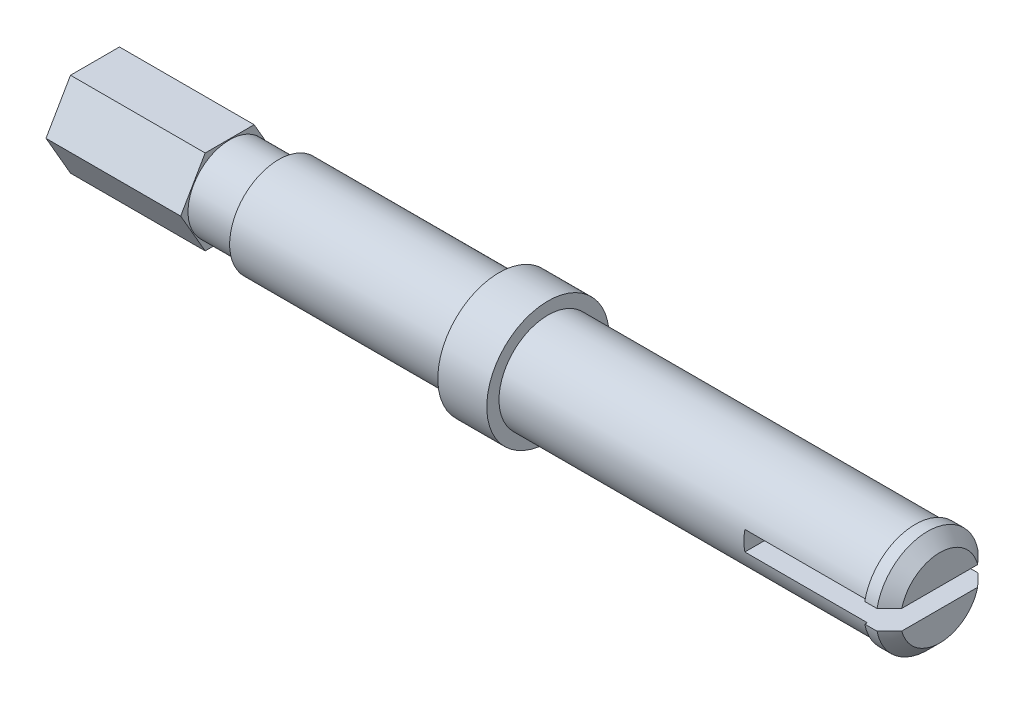
from build123d import *

# Parameters (mm, degrees)
EXTRUDE_1_DEPTH     = 5.5
SKETCH_2_R          = 1.7
EXTRUDE_2_DEPTH     = 2
SKETCH_3_R          = 2
EXTRUDE_3_DEPTH     = 9
SKETCH_4_R          = 2.5
EXTRUDE_4_DEPTH     = 2
SKETCH_5_R          = 2
EXTRUDE_5_DEPTH     = 16
SKETCH_6_R          = 2.1
EXTRUDE_6_DEPTH     = 1
CHAMFER_1_SIZE      = 0.5
SKETCH_7_W          = 5
SKETCH_7_H          = 0.8
CUT_EXTRUDE_1_DEPTH = 6


with BuildPart() as part:
    # 草图1 → 凸台-拉伸1 (new body)
    with BuildSketch(Plane(origin=(0, 0, 0), x_dir=(0, 0, -1), z_dir=(1, 0, 0))):
        Polygon((-2, 0), (-1, -1.732050808), (1, -1.732050808), (2, 0), (1, 1.732050808), (-1, 1.732050808), align=None)
    extrude(amount=EXTRUDE_1_DEPTH)

    # 草图2 → 凸台-拉伸2 (add)
    with BuildSketch(Plane(origin=(5.5, 0, 0), x_dir=(0, 0, -1), z_dir=(1, 0, 0))):
        Circle(SKETCH_2_R)
    extrude(amount=EXTRUDE_2_DEPTH)

    # 草图3 → 凸台-拉伸3 (add)
    with BuildSketch(Plane(origin=(7.5, 0, 0), x_dir=(0, 0, -1), z_dir=(1, 0, 0))):
        Circle(SKETCH_3_R)
    extrude(amount=EXTRUDE_3_DEPTH)

    # 草图4 → 凸台-拉伸4 (add)
    with BuildSketch(Plane(origin=(16.5, 0, 0), x_dir=(0, 0, -1), z_dir=(1, 0, 0))):
        Circle(SKETCH_4_R)
    extrude(amount=EXTRUDE_4_DEPTH)

    # 草图5 → 凸台-拉伸5 (add)
    with BuildSketch(Plane(origin=(18.5, 0, 0), x_dir=(0, 0, -1), z_dir=(1, 0, 0))):
        Circle(SKETCH_5_R)
    extrude(amount=EXTRUDE_5_DEPTH)

    # 草图6 → 凸台-拉伸6 (add)
    with BuildSketch(Plane(origin=(34.5, 0, 0), x_dir=(0, 0, -1), z_dir=(1, 0, 0))):
        Circle(SKETCH_6_R)
    extrude(amount=-EXTRUDE_6_DEPTH)

    # 倒角1
    chamfer_1_edges = [part.edges().sort_by_distance(p)[0] for p in [
        (34.5, 0, 2.1),
    ]]
    chamfer(chamfer_1_edges, length=CHAMFER_1_SIZE)

    # 草图7 → 切除-拉伸1 (cut)
    with BuildSketch(Plane(origin=(34.5, 0, 0), x_dir=(0, 0, -1), z_dir=(1, 0, 0))):
        Rectangle(SKETCH_7_W, SKETCH_7_H)
    extrude(amount=-CUT_EXTRUDE_1_DEPTH, mode=Mode.SUBTRACT)


solid = part.part
